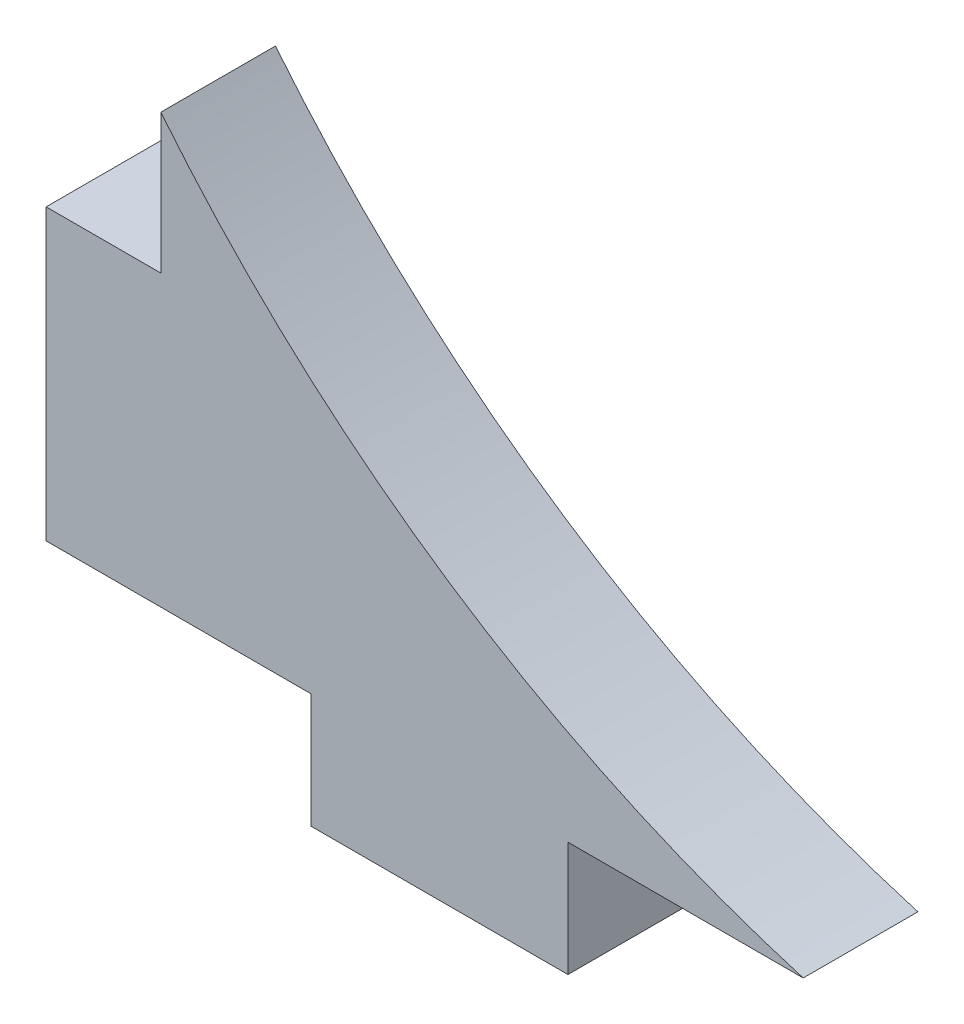
from build123d import *

# Parameters (mm, degrees)
BOSS_EXTRUDE1_DEPTH = 5.35


with BuildPart() as part:
    # Model → Boss-Extrude1 (new body)
    with BuildSketch(Plane.XY):
        with BuildLine():
            Line((5.349999992, 18.850000109), (5.349999992, 25.350000244))
            ThreePointArc((5.349999992, 25.350000244), (18.816228513, 13.067475271), (35.328051774, 5.350000109))
            Line((35.328051774, 5.350000109), (24.349999381, 5.350000109))
            Line((24.349999381, 5.350000109), (24.349999381, 0))
            Line((24.349999381, 0), (12.350000208, 0))
            Line((12.350000208, 0), (12.350000208, 5.350000109))
            Line((12.350000208, 5.350000109), (0, 5.350000109))
            Line((0, 5.350000109), (0, 18.850000109))
            Line((0, 18.850000109), (5.349999992, 18.850000109))
        make_face()
    extrude(amount=BOSS_EXTRUDE1_DEPTH)


solid = part.part
